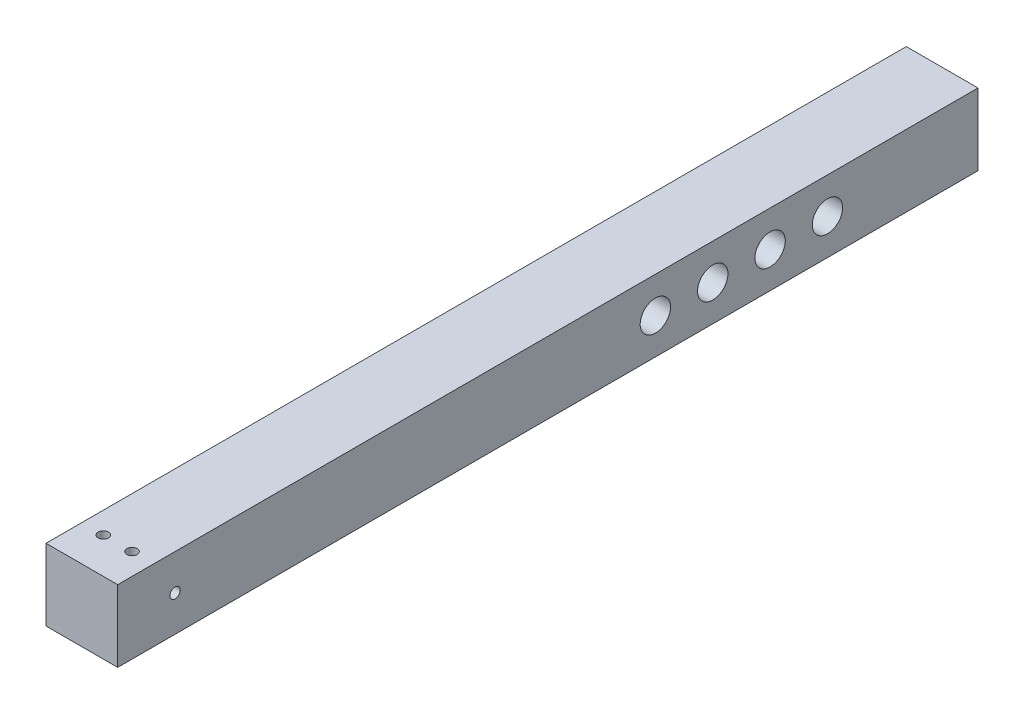
from build123d import *

# Parameters (mm, degrees)
SKETCH1_W               = 25
SKETCH1_H               = 25
BOSS_EXTRUDE1_DEPTH     = 200
SKETCH2_R               = 2.5
CUT_EXTRUDE1_DEPTH      = 202.943680268
SKETCH3_R               = 1.8
CUT_EXTRUDE2_DEPTH      = 202.943680268
SKETCH4_R               = 1.8
CUT_EXTRUDE3_DEPTH      = 202.943680268
CUT_EXTRUDE5_DEPTH      = 202.943680268
CUT_EXTRUDE5_DEPTH_BACK = 202.943680268
SKETCH6_R               = 2.5
CUT_EXTRUDE6_DEPTH      = 202.943680268
CUT_EXTRUDE6_DEPTH_BACK = 202.943680268
SKETCH7_R               = 5.3
CUT_EXTRUDE7_DEPTH      = 202.943680268
CUT_EXTRUDE7_DEPTH_BACK = 202.943680268
SKETCH8_W               = 75
SKETCH8_H               = 25


with BuildPart() as part:
    # Sketch1 → Boss-Extrude1 (new body)
    with BuildSketch(Plane.XY):
        Rectangle(SKETCH1_W, SKETCH1_H)
    boss_extrude1 = extrude(amount=BOSS_EXTRUDE1_DEPTH)

    # Sketch2 → Cut-Extrude1 (cut, through all)
    with BuildSketch(Plane(origin=(12.5, 0, 0), x_dir=(0, 0, -1), z_dir=(1, 0, 0))):
        with Locations(Location((-12.5, 0, 0), (0, 0, 90))):
            Circle(SKETCH2_R)
    cut_extrude1 = extrude(amount=-CUT_EXTRUDE1_DEPTH, mode=Mode.SUBTRACT)

    # Sketch3 → Cut-Extrude2 (cut, through all)
    with BuildSketch(Plane(origin=(0, 12.5, 0), x_dir=(1, 0, 0), z_dir=(0, 1, 0))):
        with Locations(Location((-5, -187.5, 0), (0, 0, 270))):
            Circle(SKETCH3_R)
        with Locations(Location((5, -187.5, 0), (0, 0, 270))):
            Circle(SKETCH3_R)
    cut_extrude2 = extrude(amount=-CUT_EXTRUDE2_DEPTH, mode=Mode.SUBTRACT)

    # Sketch4 → Cut-Extrude3 (cut, symmetric)
    with BuildSketch(Plane.ZY.offset(12.5)):
        with Locations(Location((180, 0, 0), (0, 0, 270))):
            Circle(SKETCH4_R)
    cut_extrude3 = extrude(amount=CUT_EXTRUDE3_DEPTH, both=True, mode=Mode.SUBTRACT)

    # Mirror2: Boss-Extrude1, Cut-Extrude1, Cut-Extrude2, Cut-Extrude3 across plane
    add(boss_extrude1.mirror(Plane(origin=(0, 0, 12.5), x_dir=(1, 0, 0), z_dir=(0, 0, -1))))
    add(cut_extrude1.mirror(Plane(origin=(0, 0, 12.5), x_dir=(1, 0, 0), z_dir=(0, 0, -1))), mode=Mode.SUBTRACT)
    add(cut_extrude2.mirror(Plane(origin=(0, 0, 12.5), x_dir=(1, 0, 0), z_dir=(0, 0, -1))), mode=Mode.SUBTRACT)
    add(cut_extrude3.mirror(Plane(origin=(0, 0, 12.5), x_dir=(1, 0, 0), z_dir=(0, 0, -1))), mode=Mode.SUBTRACT)

    # Sketch6 → Cut-Extrude5 (cut, two sides: drawn at the far end of the back side and taken through both)
    with BuildSketch(Plane(origin=(12.5, 0, 0), x_dir=(0, 0, -1), z_dir=(1, 0, 0)).offset(-CUT_EXTRUDE5_DEPTH_BACK)):
        with Locations(Location((7.5, 0, 0), (0, 0, 90))):
            Circle(SKETCH6_R)
        with Locations(Location((-12.5, 0, 0), (0, 0, 90))):
            Circle(SKETCH6_R)
        with Locations(Location((27.5, 0, 0), (0, 0, 90))):
            Circle(SKETCH6_R)
        with Locations(Location((47.5, 0, 0), (0, 0, 90))):
            Circle(SKETCH6_R)
    extrude(amount=CUT_EXTRUDE5_DEPTH + CUT_EXTRUDE5_DEPTH_BACK, mode=Mode.SUBTRACT)

    # Sketch7 → Cut-Extrude6 (cut, two sides: drawn at the far end of the back side and taken through both)
    with BuildSketch(Plane.ZY.offset(12.5).offset(-CUT_EXTRUDE6_DEPTH_BACK)):
        with Locations(Location((-47.5, 0, 0), (0, 0, 270))):
            Circle(SKETCH7_R)
        with Locations(Location((-27.5, 0, 0), (0, 0, 270))):
            Circle(SKETCH7_R)
        with Locations(Location((-7.5, 0, 0), (0, 0, 270))):
            Circle(SKETCH7_R)
        with Locations(Location((12.5, 0, 0), (0, 0, 270))):
            Circle(SKETCH7_R)
    extrude(amount=CUT_EXTRUDE6_DEPTH + CUT_EXTRUDE6_DEPTH_BACK, mode=Mode.SUBTRACT)

    # Sketch8 → Cut-Extrude7 (cut, two sides: drawn at the far end of the back side and taken through both)
    with BuildSketch(Plane.ZY.offset(12.5).offset(-CUT_EXTRUDE7_DEPTH_BACK)):
        with Locations((-137.5, 0)):
            Rectangle(SKETCH8_W, SKETCH8_H)
    extrude(amount=CUT_EXTRUDE7_DEPTH + CUT_EXTRUDE7_DEPTH_BACK, mode=Mode.SUBTRACT)


solid = part.part
